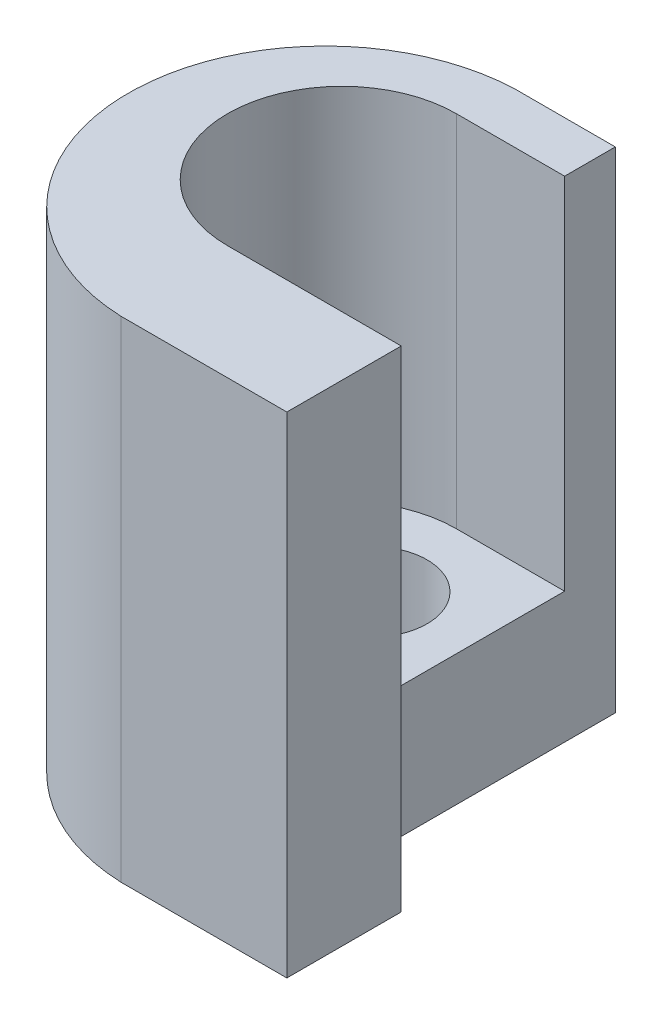
from build123d import *

# Parameters (mm, degrees)
SKETCH1_R           = 1.7
BOSS_EXTRUDE2_DEPTH = 4
BOSS_EXTRUDE3_DEPTH = 15


with BuildPart() as part:
    # Sketch1 → Boss-Extrude2 (new body)
    with BuildSketch(Plane(origin=(0, 0, 0), x_dir=(1, 0, 0), z_dir=(0, 1, 0))):
        with BuildLine():
            Line((-11.023477569, 2.96663632), (-11.023477569, -4.03336368))
            Line((-11.023477569, -4.03336368), (-14.338233671, -4.03336368))
            ThreePointArc((-14.338233671, -4.03336368), (-17.838233671, -0.53336368), (-14.338233671, 2.96663632))
            Line((-14.338233671, 2.96663632), (-11.023477569, 2.96663632))
        make_face()
        with Locations(Location((-13.963477569, -0.00336368, 0), (0, 0, 270))):
            Circle(SKETCH1_R, mode=Mode.SUBTRACT)
    extrude(amount=BOSS_EXTRUDE2_DEPTH)

    # Sketch2 → Boss-Extrude3 (add)
    with BuildSketch(Plane(origin=(0, 0, 0), x_dir=(1, 0, 0), z_dir=(0, 1, 0))):
        with BuildLine():
            Line((-11.023477569, 2.96663632), (-11.023477569, 4.517571778))
            Line((-11.023477569, 4.517571778), (-14.103477569, 4.517571778))
            ThreePointArc((-14.103477569, 4.517571778), (-19.899728462, -1.507895951), (-14.103477569, -7.53336368))
            Line((-14.103477569, -7.53336368), (-9.023477569, -7.53336368))
            Line((-9.023477569, -7.53336368), (-9.023477569, -4.03336368))
            Line((-9.023477569, -4.03336368), (-11.023477569, -4.03336368))
            Line((-11.023477569, -4.03336368), (-14.338233671, -4.03336368))
            ThreePointArc((-14.338233671, -4.03336368), (-17.838233671, -0.53336368), (-14.338233671, 2.96663632))
            Line((-14.338233671, 2.96663632), (-11.023477569, 2.96663632))
        make_face()
    extrude(amount=BOSS_EXTRUDE3_DEPTH)


solid = part.part
